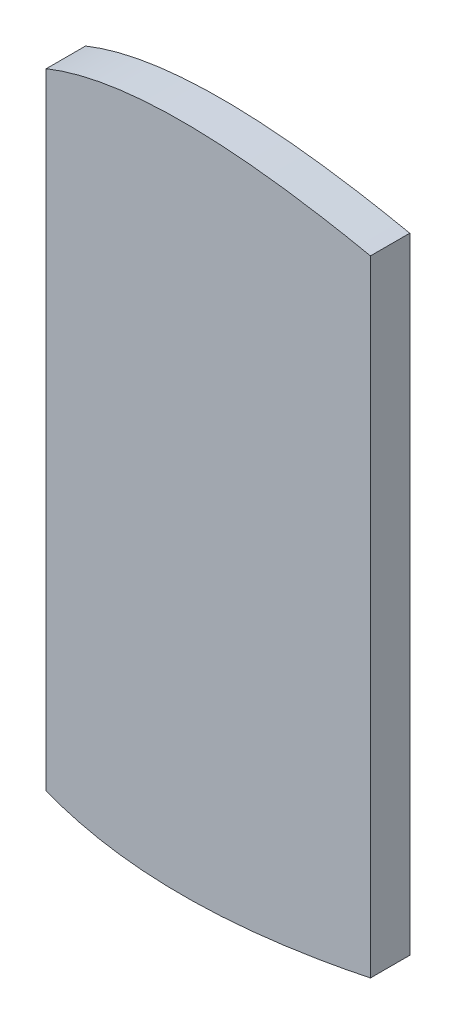
from build123d import *

# Parameters (mm, degrees)
SKETCH1_W           = 72.58
SKETCH1_H           = 140
BOSS_EXTRUDE1_DEPTH = 8.8


with BuildPart() as part:
    # Sketch1 → Boss-Extrude1 (new body)
    with BuildSketch(Plane.XY):
        with BuildLine():
            add(Edge.make_bspline(
                [(37.8955125, 48), (62.6455125, 58), (110.4755125, 48)],
                knots=[0, 0, 0, 1, 1, 1], degree=2))
            Line((110.4755125, 48), (37.8955125, 48))
        make_face()
        with Locations((74.1855125, -22)):
            Rectangle(SKETCH1_W, SKETCH1_H)
        with BuildLine():
            Line((110.4755125, -92), (37.8955125, -92))
            add(Edge.make_bspline(
                [(37.8955125, -92), (62.6455125, -102), (110.4755125, -92)],
                knots=[0, 0, 0, 1, 1, 1], degree=2))
        make_face()
    extrude(amount=BOSS_EXTRUDE1_DEPTH)


solid = part.part
